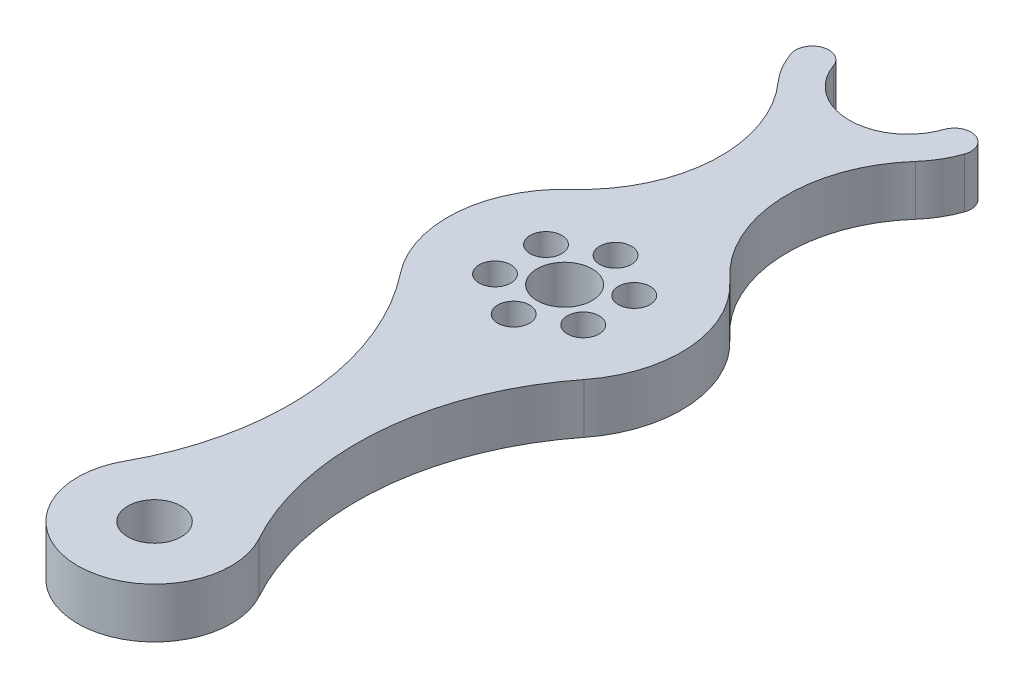
from build123d import *

# Parameters (mm, degrees)
SKETCH1_R           = 1.65
BOSS_EXTRUDE1_DEPTH = 3
SKETCH2_R           = 1.6
BOSS_EXTRUDE2_DEPTH = 3
SKETCH3_R           = 0.95
CUT_EXTRUDE1_DEPTH  = 99.001298809


with BuildPart() as part:
    # Sketch1 → Boss-Extrude1 (new body)
    with BuildSketch(Plane(origin=(0, 0, 0), x_dir=(1, 0, 0), z_dir=(0, 1, 0))):
        with BuildLine():
            ThreePointArc((-4.721587007, -63.38854654), (0, -75.556390977), (4.721587007, -63.38854654))
            ThreePointArc((4.721587007, -63.38854654), (2.011300437, -57.650074902), (4.111268391, -51.661264952))
            ThreePointArc((4.111268391, -51.661264952), (4.746967497, -50.785668514), (5.198942096, -49.802560464))
            ThreePointArc((5.198942096, -49.802560464), (4.579991672, -48.53098649), (3.308417698, -49.149936914))
            ThreePointArc((3.308417698, -49.149936914), (0, -51.507845701), (-3.308417698, -49.149936914))
            ThreePointArc((-3.308417698, -49.149936914), (-4.579991672, -48.53098649), (-5.198942096, -49.802560464))
            ThreePointArc((-5.198942096, -49.802560464), (-4.746967497, -50.785668514), (-4.111268391, -51.661264952))
            ThreePointArc((-4.111268391, -51.661264952), (-2.011300437, -57.650074902), (-4.721587007, -63.38854654))
        make_face()
        with Locations(Location((0, -68.556390977, 0), (0, 0, 270))):
            Circle(SKETCH1_R, mode=Mode.SUBTRACT)
    extrude(amount=BOSS_EXTRUDE1_DEPTH)

    # Sketch2 → Boss-Extrude2 (add)
    with BuildSketch(Plane.XZ):
        with BuildLine():
            ThreePointArc((-4.029144211, 90.885477552), (0, 97.704936254), (4.029144211, 90.885477552))
            ThreePointArc((4.029144211, 90.885477552), (2.054398705, 81.663604808), (5.501134896, 72.885076096))
            ThreePointArc((5.501134896, 72.885076096), (0, 75.556390977), (-5.501134896, 72.885076096))
            ThreePointArc((-5.501134896, 72.885076096), (-2.054398705, 81.663604808), (-4.029144211, 90.885477552))
        make_face()
        with Locations(Location((0, 93.104936254, 0), (0, 0, 270))):
            Circle(SKETCH2_R, mode=Mode.SUBTRACT)
    extrude(amount=-BOSS_EXTRUDE2_DEPTH)

    # Sketch3 → Cut-Extrude1 (cut, through all)
    with BuildSketch(Plane(origin=(0, 3, 0), x_dir=(1, 0, 0), z_dir=(0, 1, 0))):
        with Locations(Location((0, -65.506390977, 0), (0, 0, 270))):
            Circle(SKETCH3_R)
        with Locations(Location((2.641377482, -67.031390977, 0), (0, 0, 270))):
            Circle(SKETCH3_R)
        with Locations(Location((2.641377482, -70.081390977, 0), (0, 0, 270))):
            Circle(SKETCH3_R)
        with Locations(Location((0, -71.606390977, 0), (0, 0, 270))):
            Circle(SKETCH3_R)
        with Locations(Location((-2.641377482, -70.081390977, 0), (0, 0, 270))):
            Circle(SKETCH3_R)
        with Locations(Location((-2.641377482, -67.031390977, 0), (0, 0, 270))):
            Circle(SKETCH3_R)
    extrude(amount=-CUT_EXTRUDE1_DEPTH, mode=Mode.SUBTRACT)


solid = part.part
